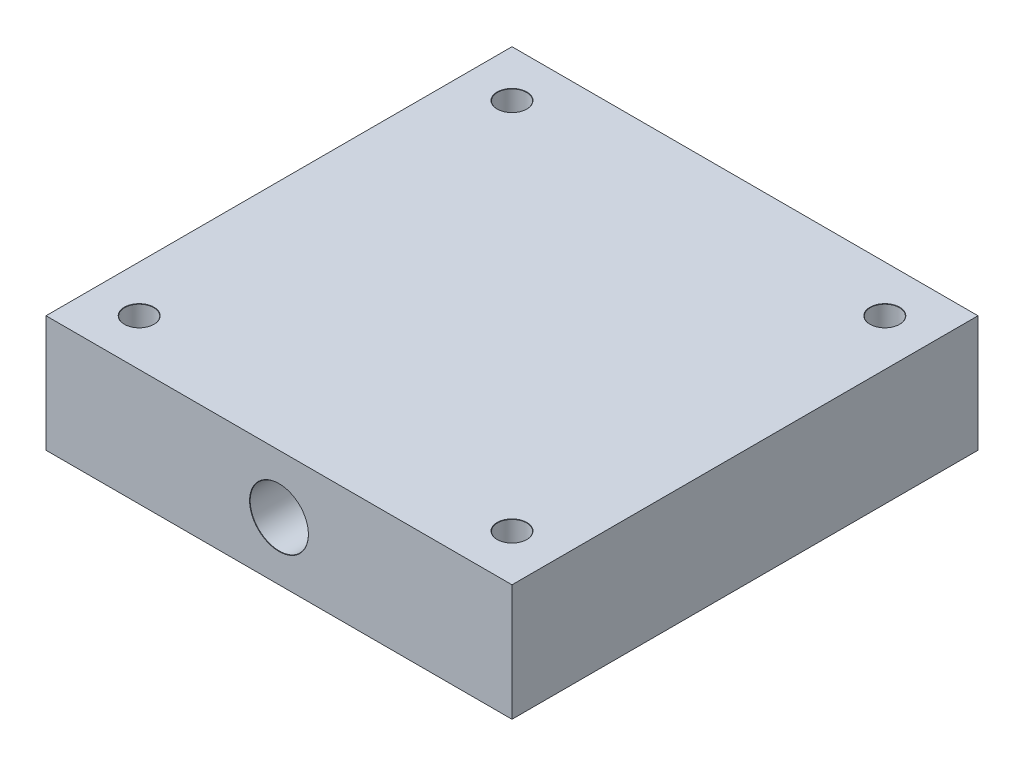
from build123d import *

# Parameters (mm, degrees)
ESQUISSE1_W                                         = 40
ESQUISSE1_H                                         = 40
BOSS_EXTRU_1_DEPTH                                  = 10
DIAM_TRE_DU_PER_AGE_4_0_4_1_D                       = 4
TROU_POUR_TARAUDAGE_POUR_TROU_TARAUD_M6_D           = 5
TROU_POUR_TARAUDAGE_POUR_TROU_TARAUD_M6_DEPTH       = 8
TROU_POUR_TARAUDAGE_POUR_TROU_TARAUD_M6_CSINK_D     = 5.05
TROU_POUR_TARAUDAGE_POUR_TROU_TARAUD_M6_CSINK_ANGLE = 90
TROU_POUR_TARAUDAGE_POUR_TROU_TARAUD_M6_TIP         = 1.502151548
DIAM_TRE_DU_PER_AGE_6_0_6_1_D                       = 6
DIAM_TRE_DU_PER_AGE_6_0_6_1_DEPTH                   = 20
DIAM_TRE_DU_PER_AGE_6_0_6_1_TIP                     = 1.802581857
TROU_POUR_TARAUDAGE_POUR_TROU_TARAUD_2_COUNT        = 2
TROU_POUR_TARAUDAGE_POUR_TROU_TARAUD_2_PITCH        = 32
TROU_POUR_TARAUDAGE_POUR_TROU_TARAUD_3_COUNT        = 2
TROU_POUR_TARAUDAGE_POUR_TROU_TARAUD_3_PITCH        = 45.254833996
TROU_POUR_TARAUDAGE_POUR_TROU_TARAUD_4_COUNT        = 2
TROU_POUR_TARAUDAGE_POUR_TROU_TARAUD_4_PITCH        = 32
TROU_POUR_TARAUDAGE_POUR_TROU_TARAUD_5_D            = 2.5
TROU_POUR_TARAUDAGE_POUR_TROU_TARAUD_5_DEPTH        = 5
TROU_POUR_TARAUDAGE_POUR_TROU_TARAUD_5_CSINK_D      = 2.55
TROU_POUR_TARAUDAGE_POUR_TROU_TARAUD_5_CSINK_ANGLE  = 90
TROU_POUR_TARAUDAGE_POUR_TROU_TARAUD_5_TIP          = 0.751075774


with BuildPart() as part:
    # Esquisse1 → Boss.-Extru.1 (new body)
    with BuildSketch(Plane(origin=(0, 0, 0), x_dir=(1, 0, 0), z_dir=(0, 1, 0))):
        with Locations((20, 20)):
            Rectangle(ESQUISSE1_W, ESQUISSE1_H)
    extrude(amount=BOSS_EXTRU_1_DEPTH)

    # Diamètre du perçage Ø4.0 (4)1 (through all)
    with Locations(Plane.XY):
        with Locations((20, 5)):
            Hole(DIAM_TRE_DU_PER_AGE_4_0_4_1_D / 2)

    # Trou pour taraudage pour trou taraudé M61
    with Locations(Plane.XY):
        with Locations((20, 5)):
            CounterSinkHole(TROU_POUR_TARAUDAGE_POUR_TROU_TARAUD_M6_D / 2, TROU_POUR_TARAUDAGE_POUR_TROU_TARAUD_M6_CSINK_D / 2, depth=TROU_POUR_TARAUDAGE_POUR_TROU_TARAUD_M6_DEPTH, counter_sink_angle=TROU_POUR_TARAUDAGE_POUR_TROU_TARAUD_M6_CSINK_ANGLE)
            with Locations((0, 0, -(TROU_POUR_TARAUDAGE_POUR_TROU_TARAUD_M6_DEPTH + TROU_POUR_TARAUDAGE_POUR_TROU_TARAUD_M6_TIP / 2))):  # 118° drill point
                Cone(0, TROU_POUR_TARAUDAGE_POUR_TROU_TARAUD_M6_D / 2, TROU_POUR_TARAUDAGE_POUR_TROU_TARAUD_M6_TIP, mode=Mode.SUBTRACT)

    # Diamètre du perçage Ø6.0 (6)1
    with Locations(Plane(origin=(0, 0, -40), x_dir=(-1, 0, 0), z_dir=(0, 0, -1))):
        with Locations((-20, 5)):
            Hole(DIAM_TRE_DU_PER_AGE_6_0_6_1_D / 2, depth=DIAM_TRE_DU_PER_AGE_6_0_6_1_DEPTH)
            with Locations((0, 0, -(DIAM_TRE_DU_PER_AGE_6_0_6_1_DEPTH + DIAM_TRE_DU_PER_AGE_6_0_6_1_TIP / 2))):  # 118° drill point
                Cone(0, DIAM_TRE_DU_PER_AGE_6_0_6_1_D / 2, DIAM_TRE_DU_PER_AGE_6_0_6_1_TIP, mode=Mode.SUBTRACT)

    # Esquisse17 → Trou pour taraudage pour trou taraud_ M3 (revolve, cut)
    with BuildSketch(Plane(origin=(4, 0, -4), x_dir=(0, 0, -1), z_dir=(1, 0, 0))):
        Polygon((0, 0), (0, 10), (1.275, 10), (1.25, 9.975), (1.25, 0.025), (1.275, 0), align=None)
    trou_pour_taraudage_pour_trou_taraud_m3 = revolve(axis=Axis((4, -6.35, -4), (0, 1, 0)), mode=Mode.SUBTRACT)

    # Trou pour taraudage pour trou taraud 2: Trou pour taraudage pour trou taraud_ M3 ×2
    with Locations(*[(i * TROU_POUR_TARAUDAGE_POUR_TROU_TARAUD_2_PITCH, 0, 0) for i in range(1, TROU_POUR_TARAUDAGE_POUR_TROU_TARAUD_2_COUNT)]):
        add(trou_pour_taraudage_pour_trou_taraud_m3, mode=Mode.SUBTRACT)

    # Trou pour taraudage pour trou taraud 3: Trou pour taraudage pour trou taraud_ M3 ×2
    with Locations(*[Vector(0.7071067811865475, 0, -0.7071067811865476) * (i * TROU_POUR_TARAUDAGE_POUR_TROU_TARAUD_3_PITCH) for i in range(1, TROU_POUR_TARAUDAGE_POUR_TROU_TARAUD_3_COUNT)]):
        add(trou_pour_taraudage_pour_trou_taraud_m3, mode=Mode.SUBTRACT)

    # Trou pour taraudage pour trou taraud 4: Trou pour taraudage pour trou taraud_ M3 ×2
    with Locations(*[(0, 0, -i * TROU_POUR_TARAUDAGE_POUR_TROU_TARAUD_4_PITCH) for i in range(1, TROU_POUR_TARAUDAGE_POUR_TROU_TARAUD_4_COUNT)]):
        add(trou_pour_taraudage_pour_trou_taraud_m3, mode=Mode.SUBTRACT)

    # Trou pour taraudage pour trou taraud 5
    with Locations(Plane(origin=(0, 0, 0), x_dir=(-1, 0, 0), z_dir=(0, -1, 0))):
        with Locations((-20, 36)):
            CounterSinkHole(TROU_POUR_TARAUDAGE_POUR_TROU_TARAUD_5_D / 2, TROU_POUR_TARAUDAGE_POUR_TROU_TARAUD_5_CSINK_D / 2, depth=TROU_POUR_TARAUDAGE_POUR_TROU_TARAUD_5_DEPTH, counter_sink_angle=TROU_POUR_TARAUDAGE_POUR_TROU_TARAUD_5_CSINK_ANGLE)
            with Locations((0, 0, -(TROU_POUR_TARAUDAGE_POUR_TROU_TARAUD_5_DEPTH + TROU_POUR_TARAUDAGE_POUR_TROU_TARAUD_5_TIP / 2))):  # 118° drill point
                Cone(0, TROU_POUR_TARAUDAGE_POUR_TROU_TARAUD_5_D / 2, TROU_POUR_TARAUDAGE_POUR_TROU_TARAUD_5_TIP, mode=Mode.SUBTRACT)


solid = part.part
